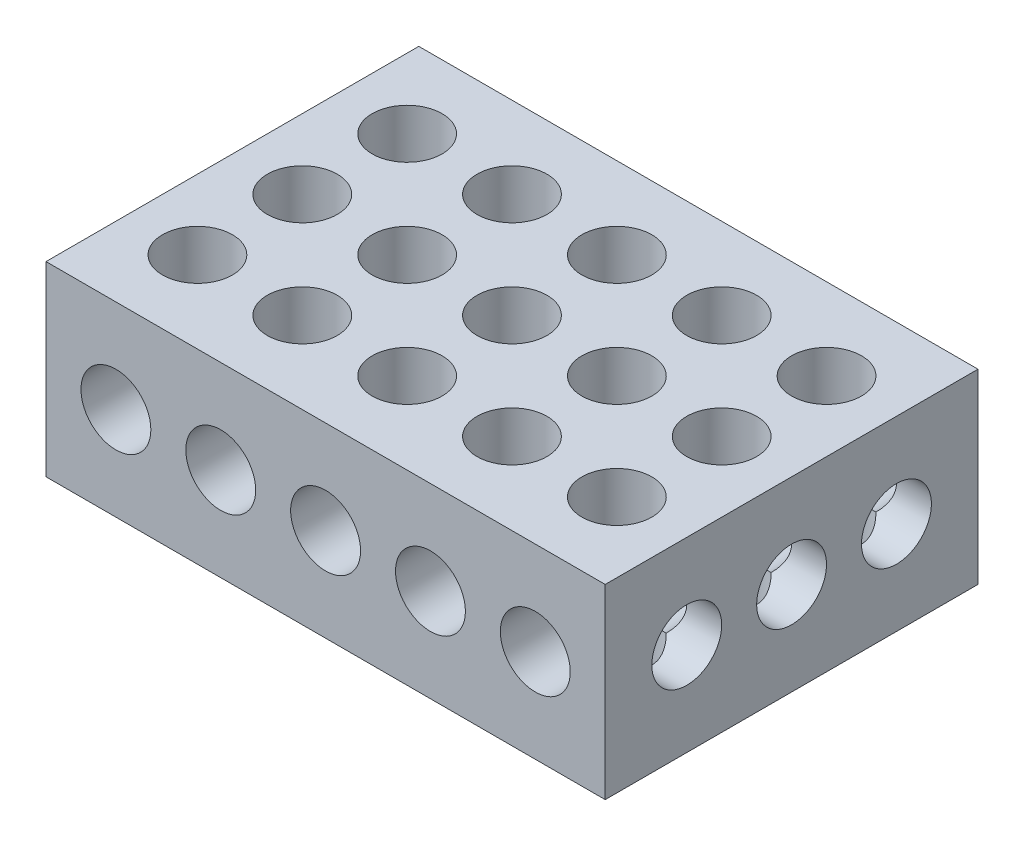
from build123d import *

# Parameters (mm, degrees)
SKETCH1_W           = 76.2
SKETCH1_H           = 50.8
BOSS_EXTRUDE1_DEPTH = 12.7
SKETCH2_R           = 4.7625
CUT_EXTRUDE1_DEPTH  = 65.757547823
SKETCH3_R           = 4.7625
CUT_EXTRUDE2_DEPTH  = 82.319677815
SKETCH4_R           = 4.7625
CUT_EXTRUDE3_DEPTH  = 53.363441445


with BuildPart() as part:
    # Sketch1 → Boss-Extrude1 (new, symmetric)
    with BuildSketch(Plane(origin=(0, 0, 0), x_dir=(1, 0, 0), z_dir=(0, 1, 0))):
        Rectangle(SKETCH1_W, SKETCH1_H)
    extrude(amount=BOSS_EXTRUDE1_DEPTH, both=True)

    # Sketch2 → Cut-Extrude1 (cut, through all)
    with BuildSketch(Plane.XY.offset(25.4)):
        with Locations((-28.575, 0)):
            Circle(SKETCH2_R)
        with Locations((-14.2875, 0)):
            Circle(SKETCH2_R)
        Circle(SKETCH2_R)
        with Locations((14.2875, 0)):
            Circle(SKETCH2_R)
        with Locations((28.575, 0)):
            Circle(SKETCH2_R)
    extrude(amount=-CUT_EXTRUDE1_DEPTH, mode=Mode.SUBTRACT)

    # Sketch3 → Cut-Extrude2 (cut, through all)
    with BuildSketch(Plane.ZY.offset(38.1)):
        with Locations(Location((-14.2875, 0, 0), (0, 0, 270))):
            Circle(SKETCH3_R)
        Circle(SKETCH3_R)
        with Locations((14.2875, 0)):
            Circle(SKETCH3_R)
    extrude(amount=-CUT_EXTRUDE2_DEPTH, mode=Mode.SUBTRACT)

    # Sketch4 → Cut-Extrude3 (cut, through all)
    with BuildSketch(Plane(origin=(0, 12.7, 0), x_dir=(1, 0, 0), z_dir=(0, 1, 0))):
        with Locations(Location((-28.575, 14.2875, 0), (0, 0, 270))):
            Circle(SKETCH4_R)
        with Locations(Location((-14.2875, 14.2875, 0), (0, 0, 270))):
            Circle(SKETCH4_R)
        with Locations(Location((0, 14.2875, 0), (0, 0, 270))):
            Circle(SKETCH4_R)
        with Locations(Location((14.2875, 14.2875, 0), (0, 0, 270))):
            Circle(SKETCH4_R)
        with Locations(Location((28.575, 14.2875, 0), (0, 0, 270))):
            Circle(SKETCH4_R)
        with Locations(Location((-14.2875, 0, 0), (0, 0, 270))):
            Circle(SKETCH4_R)
        with Locations(Location((0, 0, 0), (0, 0, 270))):
            Circle(SKETCH4_R)
        with Locations(Location((14.2875, 0, 0), (0, 0, 270))):
            Circle(SKETCH4_R)
        with Locations(Location((28.575, 0, 0), (0, 0, 270))):
            Circle(SKETCH4_R)
        with Locations(Location((-14.2875, -14.2875, 0), (0, 0, 270))):
            Circle(SKETCH4_R)
        with Locations(Location((0, -14.2875, 0), (0, 0, 270))):
            Circle(SKETCH4_R)
        with Locations(Location((14.2875, -14.2875, 0), (0, 0, 270))):
            Circle(SKETCH4_R)
        with Locations(Location((28.575, -14.2875, 0), (0, 0, 270))):
            Circle(SKETCH4_R)
        with Locations(Location((-28.575, 0, 0), (0, 0, 270))):
            Circle(SKETCH4_R)
        with Locations(Location((-28.575, -14.2875, 0), (0, 0, 270))):
            Circle(SKETCH4_R)
    extrude(amount=-CUT_EXTRUDE3_DEPTH, mode=Mode.SUBTRACT)


solid = part.part
